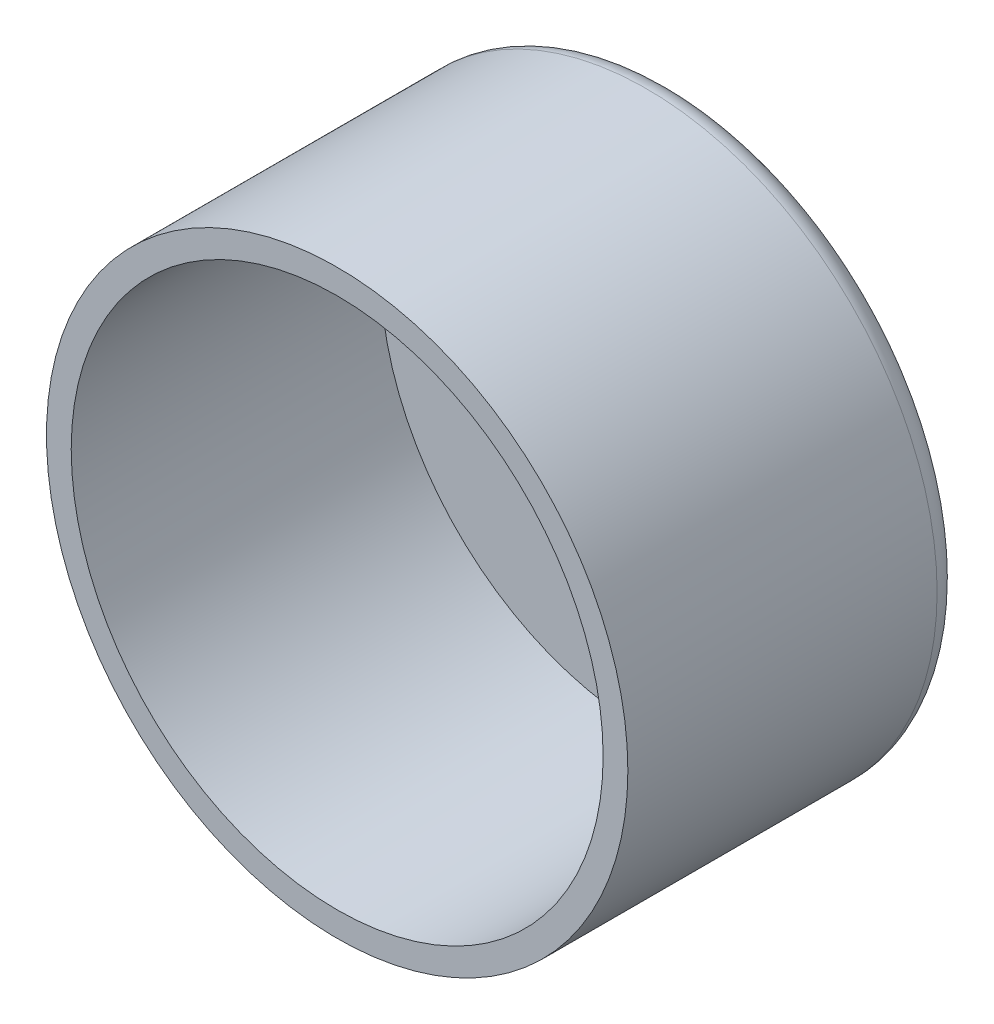
from build123d import *

# Parameters (mm, degrees)
SKETCH1_R           = 23.5
BOSS_EXTRUDE1_DEPTH = 27
SHELL1_T            = -2
FILLET1_R           = 2


with BuildPart() as part:
    # Sketch1 → Boss-Extrude1 (new body)
    with BuildSketch(Plane.XY):
        Circle(SKETCH1_R)
    extrude(amount=BOSS_EXTRUDE1_DEPTH)

    # Shell1
    shell1_openings = [part.faces().sort_by_distance(p)[0] for p in [
        (0, 0, 27),
    ]]
    offset(amount=SHELL1_T, openings=shell1_openings, kind=Kind.INTERSECTION)

    # Fillet1
    fillet1_edges = [part.edges().sort_by_distance(p)[0] for p in [
        (-23.5, 0, 0),
    ]]
    fillet(fillet1_edges, radius=FILLET1_R)


solid = part.part
